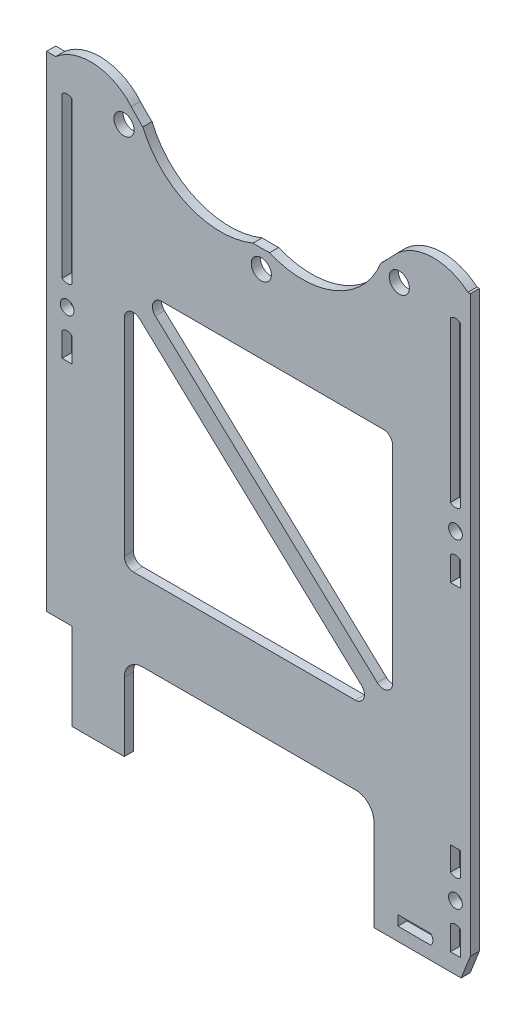
from build123d import *

# Parameters (mm, degrees)
SKETCH_3_R      = 2.2
SKETCH_3_R_2    = 1.5
EXTRUDE_1_DEPTH = 2


with BuildPart() as part:
    # 草图3 → 凸台-拉伸1 (new body)
    with BuildSketch(Plane.XY):
        with BuildLine():
            Line((-41.4, -74.890216685), (-41.4, -93.890216685))
            Line((-41.4, -93.890216685), (-30, -93.890216685))
            Line((-30, -93.890216685), (-30, -78.890216685))
            ThreePointArc((-30, -78.890216685), (-28.828427125, -76.061789561), (-26, -74.890216685))
            Line((-26, -74.890216685), (20.641271636, -74.890216685))
            ThreePointArc((20.641271636, -74.890216685), (23.469698761, -76.061789561), (24.641271636, -78.890216685))
            Line((24.641271636, -78.890216685), (24.641271636, -93.890216685))
            Line((24.641271636, -93.890216685), (24.641271636, -97.990216685))
            Line((24.641271636, -97.990216685), (24.641271636, -98.990216685))
            Line((24.641271636, -98.990216685), (43.741271636, -98.990216685))
            Line((43.741271636, -98.990216685), (45.741271636, -93.890216685))
            Line((45.741271636, -93.890216685), (45.741271636, 31.741152315))
            Line((45.741271636, 31.741152315), (45.230037269, 31.741152315))
            ThreePointArc((45.230037269, 31.741152315), (36.686440181, 34.468680322), (28.716551195, 30.356098435))
            ThreePointArc((28.716551195, 30.356098435), (27.478316584, 29.033500084), (26.179230338, 27.770619934))
            ThreePointArc((26.179230338, 27.770619934), (16.152230905, 17.515551518), (1.809761925, 17.542559084))
            ThreePointArc((1.809761925, 17.542559084), (0, 17.5), (-1.809761925, 17.542559084))
            ThreePointArc((-1.809761925, 17.542559084), (-15.928828372, 17.542283516), (-25.912710857, 27.525776288))
            ThreePointArc((-25.912710857, 27.525776288), (-27.223611076, 28.776388924), (-28.474223712, 30.087289143))
            ThreePointArc((-28.474223712, 30.087289143), (-36.482419799, 34.124770496), (-45, 31.317051182))
            Line((-45, 31.317051182), (-47, 31.317051182))
            Line((-47, 31.317051182), (-47, -74.890216685))
            Line((-47, -74.890216685), (-41.4, -74.890216685))
        make_face()
        with Locations((0, 13.5)):
            Circle(SKETCH_3_R, mode=Mode.SUBTRACT)
        with Locations((-30.052038202, 25.947961669)):
            Circle(SKETCH_3_R, mode=Mode.SUBTRACT)
        with Locations((30.199957913, 26.082571452)):
            Circle(SKETCH_3_R, mode=Mode.SUBTRACT)
        with Locations((42.5, -14.940216685)):
            Circle(SKETCH_3_R_2, mode=Mode.SUBTRACT)
        with Locations(Location((-42.5, -14.940216685, 0), (0, 0, 180))):
            Circle(SKETCH_3_R_2, mode=Mode.SUBTRACT)
        with Locations((42.5, -84.940216685)):
            Circle(SKETCH_3_R_2, mode=Mode.SUBTRACT)
        with BuildLine():
            Line((-43.6, -9.990216685), (-43.6, 25.009783315))
            ThreePointArc((-43.6, 25.009783315), (-42.5, 25.465418233), (-41.4, 25.009783315))
            Line((-41.4, 25.009783315), (-41.4, -9.990216685))
            ThreePointArc((-41.4, -9.990216685), (-42.5, -10.445851604), (-43.6, -9.990216685))
        make_face(mode=Mode.SUBTRACT)
        with BuildLine():
            Line((-41.4, -19.890216685), (-41.4, -25.190216685))
            Line((-41.4, -25.190216685), (-43.6, -25.190216685))
            Line((-43.6, -25.190216685), (-43.6, -19.890216685))
            ThreePointArc((-43.6, -19.890216685), (-42.5, -19.434581767), (-41.4, -19.890216685))
        make_face(mode=Mode.SUBTRACT)
        with BuildLine():
            Line((37.1, -93.890216685), (29.9, -93.890216685))
            Line((29.9, -93.890216685), (29.9, -96.090216685))
            Line((29.9, -96.090216685), (37.1, -96.090216685))
            ThreePointArc((37.1, -96.090216685), (37.555634919, -94.990216685), (37.1, -93.890216685))
        make_face(mode=Mode.SUBTRACT)
        with BuildLine():
            Line((43.6, -25.190216685), (43.6, -19.890216685))
            ThreePointArc((43.6, -19.890216685), (42.5, -19.434581767), (41.4, -19.890216685))
            Line((41.4, -19.890216685), (41.4, -25.190216685))
            Line((41.4, -25.190216685), (43.6, -25.190216685))
        make_face(mode=Mode.SUBTRACT)
        with BuildLine():
            Line((43.6, -95.190216685), (43.6, -89.890216685))
            ThreePointArc((43.6, -89.890216685), (42.5, -89.434581767), (41.4, -89.890216685))
            Line((41.4, -89.890216685), (41.4, -95.190216685))
            Line((41.4, -95.190216685), (43.6, -95.190216685))
        make_face(mode=Mode.SUBTRACT)
        with BuildLine():
            Line((41.4, -74.890216685), (41.4, -80.090216685))
            ThreePointArc((41.4, -80.090216685), (42.5, -80.545851604), (43.6, -80.090216685))
            Line((43.6, -80.090216685), (43.6, -74.890216685))
            Line((43.6, -74.890216685), (41.4, -74.890216685))
        make_face(mode=Mode.SUBTRACT)
        with BuildLine():
            Line((41.4, 25.009783315), (41.4, -9.990216685))
            ThreePointArc((41.4, -9.990216685), (42.5, -10.445851604), (43.6, -9.990216685))
            Line((43.6, -9.990216685), (43.6, 25.009783315))
            ThreePointArc((43.6, 25.009783315), (42.5, 25.465418233), (41.4, 25.009783315))
        make_face(mode=Mode.SUBTRACT)
        with BuildLine():
            Line((-21.830528741, -3.5), (26.741271636, -3.5))
            ThreePointArc((26.741271636, -3.5), (28.155485198, -4.085786438), (28.741271636, -5.5))
            Line((28.741271636, -5.5), (28.741271636, -50.70338646))
            ThreePointArc((28.741271636, -50.70338646), (27.539684971, -52.537108399), (25.378735489, -52.167454508))
            Line((25.378735489, -52.167454508), (-23.193064888, -6.964068047))
            ThreePointArc((-23.193064888, -6.964068047), (-23.691729441, -4.767926266), (-21.830528741, -3.5))
        make_face(mode=Mode.SUBTRACT)
        with BuildLine():
            Line((-26.637463853, -9.222762177), (21.934336524, -54.426148638))
            ThreePointArc((21.934336524, -54.426148638), (22.433001077, -56.62229042), (20.571800377, -57.890216685))
            Line((20.571800377, -57.890216685), (-28, -57.890216685))
            ThreePointArc((-28, -57.890216685), (-29.414213562, -57.304430248), (-30, -55.890216685))
            Line((-30, -55.890216685), (-30, -10.686830225))
            ThreePointArc((-30, -10.686830225), (-28.798413335, -8.853108286), (-26.637463853, -9.222762177))
        make_face(mode=Mode.SUBTRACT)
    extrude(amount=EXTRUDE_1_DEPTH)


solid = part.part
